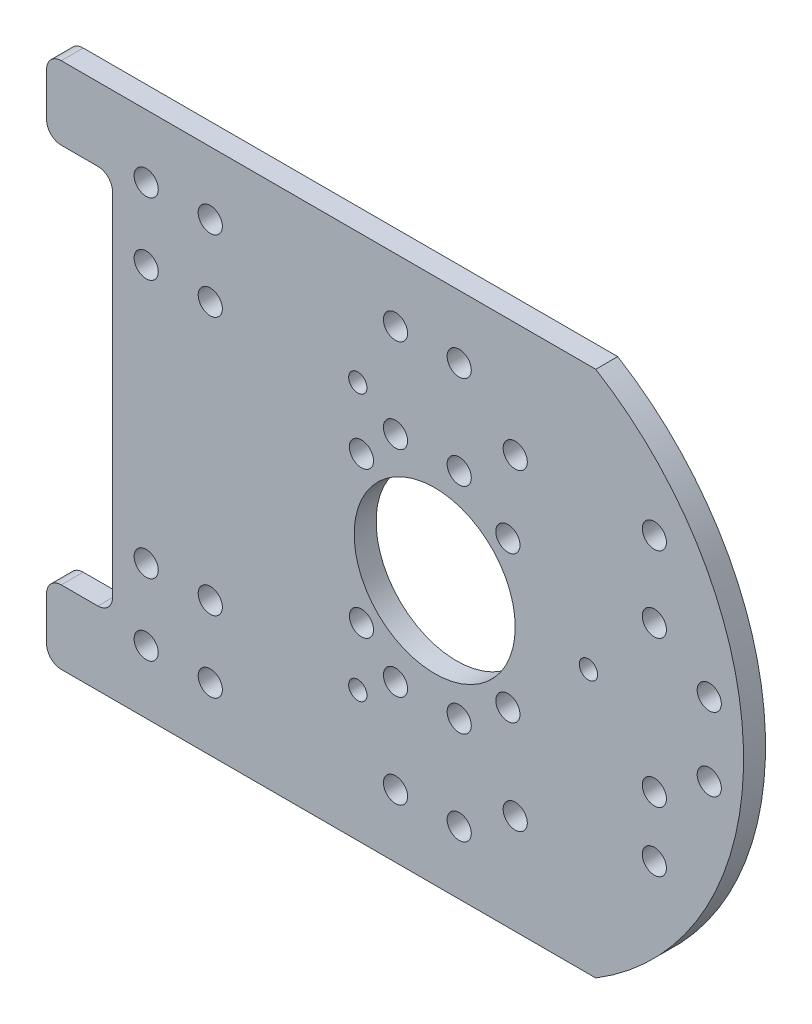
from build123d import *

# Parameters (mm, degrees)
SKETCH_3_R      = 1.65
SKETCH_3_R_2    = 1.25
EXTRUDE_2_DEPTH = 3
FILLET_2_R      = 2


with BuildPart() as part:
    # 草图3 → 凸台-拉伸2 (new body)
    with BuildSketch(Plane.XY):
        with BuildLine():
            Line((9, 10), (0, 10))
            Line((0, 10), (0, 0))
            Line((0, 0), (75, 0))
            ThreePointArc((75, 0), (95.190046219, 36), (75, 72))
            Line((75, 72), (0, 72))
            Line((0, 72), (0, 62))
            Line((0, 62), (9, 62))
            Line((9, 62), (9, 10))
        make_face()
        with Locations((13.6, 8.6)):
            Circle(SKETCH_3_R, mode=Mode.SUBTRACT)
        with Locations((22.35, 8.6)):
            Circle(SKETCH_3_R, mode=Mode.SUBTRACT)
        with Locations((13.6, 18.35)):
            Circle(SKETCH_3_R, mode=Mode.SUBTRACT)
        with Locations((22.35, 18.35)):
            Circle(SKETCH_3_R, mode=Mode.SUBTRACT)
        with Locations((47.65, 8.6)):
            Circle(SKETCH_3_R, mode=Mode.SUBTRACT)
        with Locations((42.5, 17.813466521)):
            Circle(SKETCH_3_R_2, mode=Mode.SUBTRACT)
        with Locations((47.65, 21.35)):
            Circle(SKETCH_3_R, mode=Mode.SUBTRACT)
        with Locations((43, 26)):
            Circle(SKETCH_3_R, mode=Mode.SUBTRACT)
        with Locations((56.35, 8.6)):
            Circle(SKETCH_3_R, mode=Mode.SUBTRACT)
        with Locations((64, 13.65)):
            Circle(SKETCH_3_R, mode=Mode.SUBTRACT)
        with Locations((56.35, 21.35)):
            Circle(SKETCH_3_R, mode=Mode.SUBTRACT)
        with Locations((83, 17.813466521)):
            Circle(SKETCH_3_R, mode=Mode.SUBTRACT)
        with Locations((63, 26)):
            Circle(SKETCH_3_R, mode=Mode.SUBTRACT)
        with Locations((83, 26)):
            Circle(SKETCH_3_R, mode=Mode.SUBTRACT)
        with Locations((90.5, 31)):
            Circle(SKETCH_3_R, mode=Mode.SUBTRACT)
        with Locations((43, 46)):
            Circle(SKETCH_3_R, mode=Mode.SUBTRACT)
        with Locations((13.6, 53.65)):
            Circle(SKETCH_3_R, mode=Mode.SUBTRACT)
        with Locations((22.35, 53.65)):
            Circle(SKETCH_3_R, mode=Mode.SUBTRACT)
        with Locations((13.6, 63.4)):
            Circle(SKETCH_3_R, mode=Mode.SUBTRACT)
        with Locations((22.35, 63.4)):
            Circle(SKETCH_3_R, mode=Mode.SUBTRACT)
        with Locations((47.65, 50.65)):
            Circle(SKETCH_3_R, mode=Mode.SUBTRACT)
        with Locations((42.5, 54.186533479)):
            Circle(SKETCH_3_R_2, mode=Mode.SUBTRACT)
        with Locations((47.65, 63.4)):
            Circle(SKETCH_3_R, mode=Mode.SUBTRACT)
        with BuildLine():
            ThreePointArc((48.417424305, 26), (42, 36), (48.417424305, 46))
            ThreePointArc((48.417424305, 46), (64, 36), (48.417424305, 26))
        make_face(mode=Mode.SUBTRACT)
        with Locations((63, 46)):
            Circle(SKETCH_3_R, mode=Mode.SUBTRACT)
        with Locations((74, 36)):
            Circle(SKETCH_3_R_2, mode=Mode.SUBTRACT)
        with Locations((90.5, 41)):
            Circle(SKETCH_3_R, mode=Mode.SUBTRACT)
        with Locations((83, 46)):
            Circle(SKETCH_3_R, mode=Mode.SUBTRACT)
        with Locations((56.35, 50.65)):
            Circle(SKETCH_3_R, mode=Mode.SUBTRACT)
        with Locations((64, 56.35)):
            Circle(SKETCH_3_R, mode=Mode.SUBTRACT)
        with Locations((56.35, 63.4)):
            Circle(SKETCH_3_R, mode=Mode.SUBTRACT)
        with Locations((83, 56.35)):
            Circle(SKETCH_3_R, mode=Mode.SUBTRACT)
    extrude(amount=EXTRUDE_2_DEPTH)

    # 圆角2
    fillet_2_edges = [part.edges().sort_by_distance(p)[0] for p in [
        (0, 0, 1.5),
        (0, 10, 1.5),
        (9, 10, 1.5),
        (9, 62, 1.5),
        (0, 62, 1.5),
        (0, 72, 1.5),
    ]]
    fillet(fillet_2_edges, radius=FILLET_2_R)


solid = part.part
